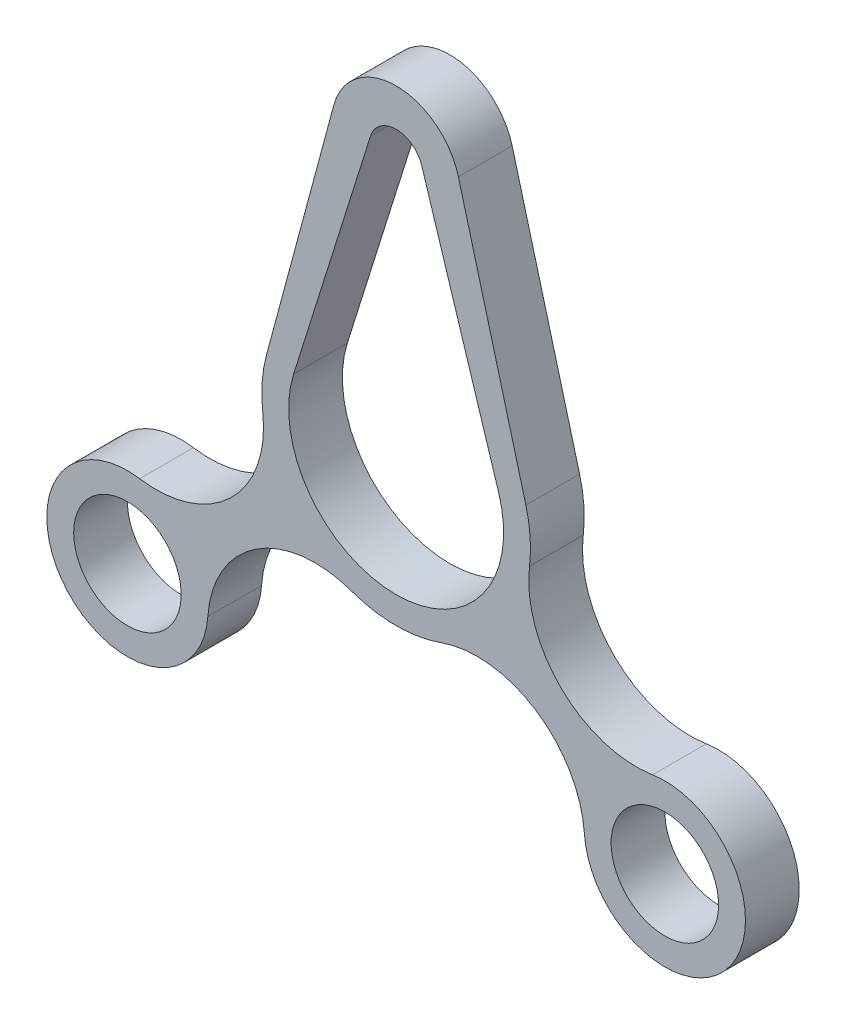
from build123d import *

# Parameters (mm, degrees)
SKETCH1_R           = 10
BOSS_EXTRUDE1_DEPTH = 5


with BuildPart() as part:
    # Sketch1 → Boss-Extrude1 (new, symmetric)
    with BuildSketch(Plane.XY):
        with BuildLine():
            Line((-11.587303396, 53.12), (-24.140215409, 6.5))
            ThreePointArc((-24.140215409, 6.5), (-24.936514863, 1.780512988), (-24.81883517, -3.004233816))
            ThreePointArc((-24.81883517, -3.004233816), (-30.762049538, -19.776348187), (-47.717387131, -25.174694658))
            ThreePointArc((-47.717387131, -25.174694658), (-61.713032142, -49.370425713), (-35.03522611, -41.027395935))
            ThreePointArc((-35.03522611, -41.027395935), (-26.046643252, -25.670606045), (-8.378996809, -23.554031767))
            ThreePointArc((-8.378996809, -23.554031767), (0, -25), (8.378996809, -23.554031767))
            ThreePointArc((8.378996809, -23.554031767), (26.046643252, -25.670606045), (35.03522611, -41.027395935))
            ThreePointArc((35.03522611, -41.027395935), (61.713032142, -49.370425713), (47.717387131, -25.174694658))
            ThreePointArc((47.717387131, -25.174694658), (30.762049538, -19.776348187), (24.81883517, -3.004233816))
            ThreePointArc((24.81883517, -3.004233816), (24.936514863, 1.780512988), (24.140215409, 6.5))
            Line((24.140215409, 6.5), (11.587303396, 53.12))
            ThreePointArc((11.587303396, 53.12), (0, 62), (-11.587303396, 53.12))
        make_face()
        with Locations((50, -40)):
            Circle(SKETCH1_R, mode=Mode.SUBTRACT)
        with Locations(Location((-50, -40, 0), (0, 0, 180))):
            Circle(SKETCH1_R, mode=Mode.SUBTRACT)
        with BuildLine():
            Line((-4.769696007, 51.5), (-19.078784028, 6))
            ThreePointArc((-19.078784028, 6), (0, -20), (19.078784028, 6))
            Line((19.078784028, 6), (4.769696007, 51.5))
            ThreePointArc((4.769696007, 51.5), (0, 55), (-4.769696007, 51.5))
        make_face(mode=Mode.SUBTRACT)
    extrude(amount=BOSS_EXTRUDE1_DEPTH, both=True)


solid = part.part
